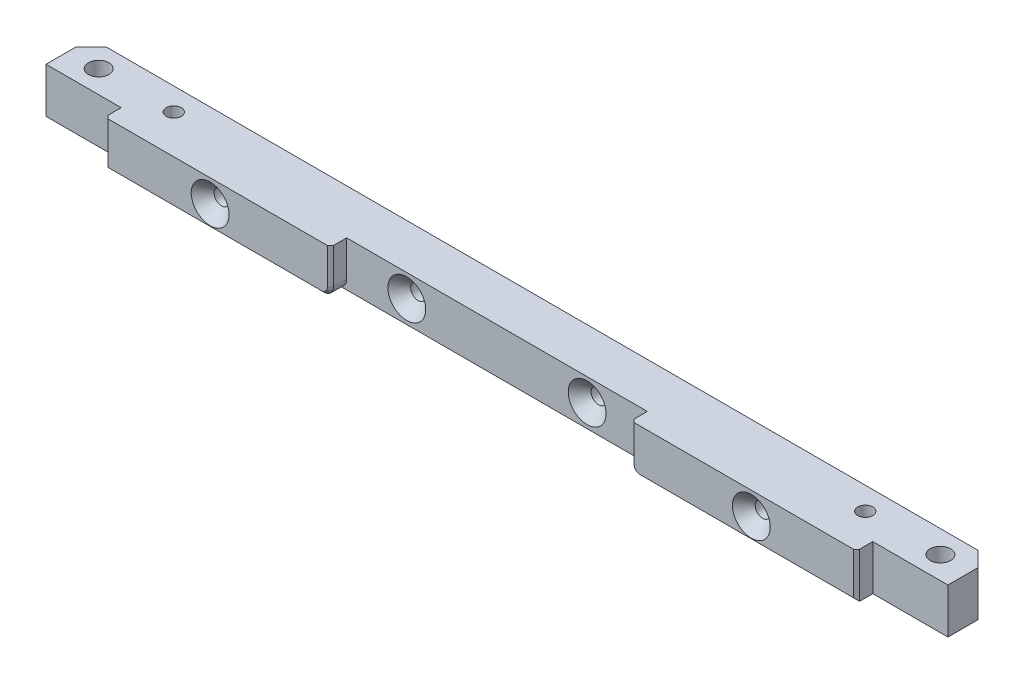
from build123d import *

# Parameters (mm, degrees)
SKETCH_1_W                   = 300
SKETCH_1_H                   = 15
EXTRUDE_345_DEPTH            = 15
HOLE_WIZARD_M6_D             = 5
HOLE_WIZARD_M8_D             = 6.8
SKETCH_8_W                   = 250
SKETCH_8_H                   = 15
EXTRUDE_2518_DEPTH           = 5.4
SKETCH_10_W                  = 100
SKETCH_10_H                  = 15
CUT_EXTRUDE_2855_DEPTH       = 5.4
HOLE_WIZARD_1_M6_D           = 5
HOLE_WIZARD_1_M6_CSINK_D     = 12.6
HOLE_WIZARD_1_M6_CSINK_ANGLE = 90
HOLE_WIZARD_2_M6_D           = 5
HOLE_WIZARD_2_M6_CSINK_D     = 12.6
HOLE_WIZARD_2_M6_CSINK_ANGLE = 90
FILLET_1_R                   = 3
CHAMFER_1_SIZE               = 5
CHAMFER_2_SIZE               = 1


with BuildPart() as part:
    # Эскиз1 → Extrude 345 (new body)
    with BuildSketch(Plane(origin=(0, 0, 0), x_dir=(1, 0, 0), z_dir=(0, 1, 0))):
        Rectangle(SKETCH_1_W, SKETCH_1_H)
    extrude(amount=EXTRUDE_345_DEPTH)

    # Крепление шарнира M6 (through all)
    with Locations(Plane(origin=(0, 15, 0), x_dir=(1, 0, 0), z_dir=(0, 1, 0))):
        with Locations((-115, 0), (115, 0)):
            Hole(HOLE_WIZARD_M6_D / 2)

    # Шпилька-M8 (through all)
    with Locations(Plane(origin=(0, 15, 0), x_dir=(1, 0, 0), z_dir=(0, 1, 0))):
        with Locations((-140, 0), (140, 0)):
            Hole(HOLE_WIZARD_M8_D / 2)

    # Эскиз8 → Extrude 2518 (add)
    with BuildSketch(Plane.XY.offset(7.5)):
        with Locations((0, 7.5)):
            Rectangle(SKETCH_8_W, SKETCH_8_H)
    extrude(amount=EXTRUDE_2518_DEPTH)

    # Эскиз10 → Cut-Extrude 2855 (cut)
    with BuildSketch(Plane.XY.offset(12.9)):
        with Locations((0, 7.5)):
            Rectangle(SKETCH_10_W, SKETCH_10_H)
    extrude(amount=-CUT_EXTRUDE_2855_DEPTH, mode=Mode.SUBTRACT)

    # Прижим-1-M6 (through all)
    with Locations(Plane.XY.offset(12.9)):
        with Locations((-90, 7.5), (90, 7.5)):
            CounterSinkHole(HOLE_WIZARD_1_M6_D / 2, HOLE_WIZARD_1_M6_CSINK_D / 2, counter_sink_angle=HOLE_WIZARD_1_M6_CSINK_ANGLE)

    # Прижим-2-M6 (through all)
    with Locations(Plane.XY.offset(7.5)):
        with Locations((-30, 7.5), (30, 7.5)):
            CounterSinkHole(HOLE_WIZARD_2_M6_D / 2, HOLE_WIZARD_2_M6_CSINK_D / 2, counter_sink_angle=HOLE_WIZARD_2_M6_CSINK_ANGLE)

    # Скругление1
    fillet_1_edges = [part.edges().sort_by_distance(p)[0] for p in [
        (-50, 0, 10.2),
        (50, 0, 10.2),
    ]]
    fillet(fillet_1_edges, radius=FILLET_1_R)

    # Фаска1
    chamfer_1_edges = [part.edges().sort_by_distance(p)[0] for p in [
        (-150, 7.5, -7.5),
        (150, 7.5, -7.5),
    ]]
    chamfer(chamfer_1_edges, length=CHAMFER_1_SIZE)

    # Фаска2
    chamfer_2_edges = [part.edges().sort_by_distance(p)[0] for p in [
        (-125, 7.5, 12.9),
        (-89, 0, 12.9),
        (125, 7.5, 12.9),
        (-50, 9, 12.9),
        (50, 9, 12.9),
        (89, 0, 12.9),
        (50.878679656, 0.878679656, 12.9),
        (-50.878679656, 0.878679656, 12.9),
    ]]
    chamfer(chamfer_2_edges, length=CHAMFER_2_SIZE)


solid = part.part
